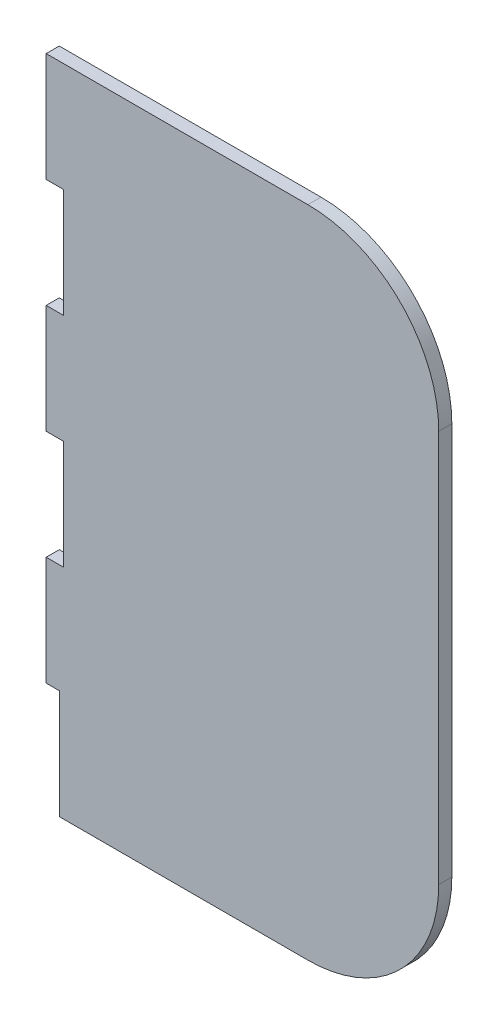
from build123d import *

# Parameters (mm, degrees)
ESQUISSE1_W             = 90
ESQUISSE1_H             = 150
BOSS_EXTRU_2_DEPTH      = 3
ESQUISSE3_W             = 3.935197626
ESQUISSE3_H             = 25
ESQUISSE3_W_2           = 3
ENL_V_MAT_EXTRU_1_DEPTH = 3
CONG_1_R                = 30


with BuildPart() as part:
    # Esquisse1 → Boss.-Extru.2 (new body)
    with BuildSketch(Plane.XY):
        with Locations((45, 75)):
            Rectangle(ESQUISSE1_W, ESQUISSE1_H)
    extrude(amount=BOSS_EXTRU_2_DEPTH)

    # Esquisse3 → Enlèv. mat.-Extru.1 (cut)
    with BuildSketch(Plane.XY.offset(3)):
        with Locations((1.967598813, 112.5)):
            Rectangle(ESQUISSE3_W, ESQUISSE3_H)
        with Locations((1.967598813, 62.5)):
            Rectangle(ESQUISSE3_W, ESQUISSE3_H)
        with Locations((1.5, 12.5)):
            Rectangle(ESQUISSE3_W_2, ESQUISSE3_H)
    extrude(amount=-ENL_V_MAT_EXTRU_1_DEPTH, mode=Mode.SUBTRACT)

    # Congé1
    cong_1_edges = [part.edges().sort_by_distance(p)[0] for p in [
        (90, 0, 1.5),
        (90, 150, 1.5),
    ]]
    fillet(cong_1_edges, radius=CONG_1_R)


solid = part.part
